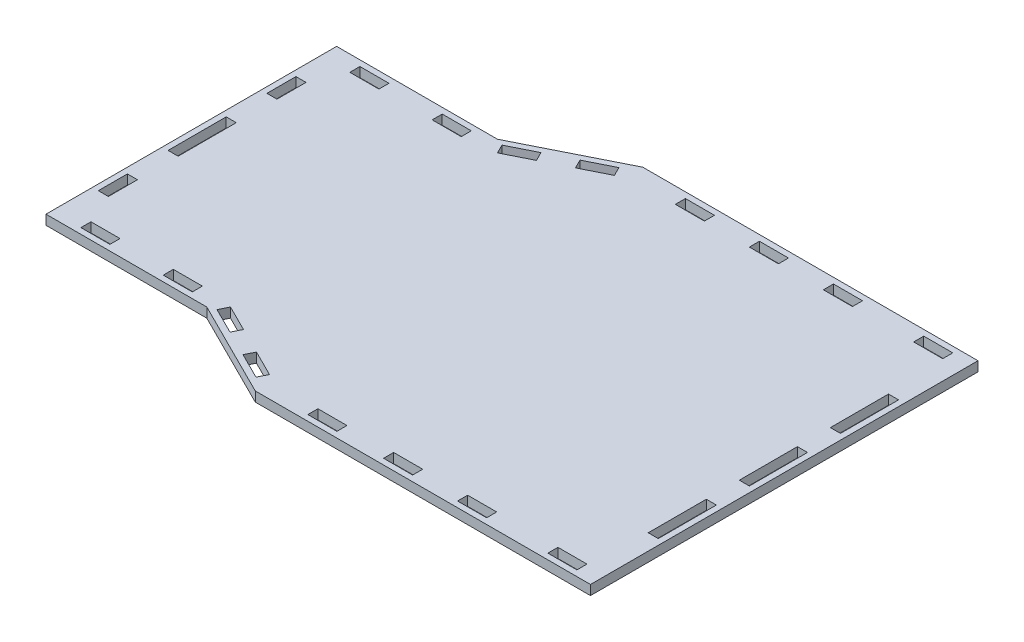
from build123d import *

# Parameters (mm, degrees)
SKETCH1_W           = 15
SKETCH1_H           = 5.2
SKETCH1_W_2         = 5.2
SKETCH1_H_2         = 30
SKETCH1_H_3         = 15
BOSS_EXTRUDE1_DEPTH = 5


with BuildPart() as part:
    # Sketch1 → Boss-Extrude1 (new body)
    with BuildSketch(Plane(origin=(0, 0, 0), x_dir=(1, 0, 0), z_dir=(0, 1, 0))):
        Polygon((92.514530464, -147.019914311), (92.514530464, 52.980085689), (-80.485469536, 52.980085689), (-130.485469536, 27.980085689), (-213.485469536, 27.980085689), (-213.485469536, -122.019914311), (-130.485469536, -122.019914311), (-80.485469536, -147.019914311), align=None)
        with Locations((75.014530464, 47.380085689)):
            Rectangle(SKETCH1_W, SKETCH1_H, mode=Mode.SUBTRACT)
        with Locations((75.014530464, -141.419914311)):
            Rectangle(SKETCH1_W, SKETCH1_H, mode=Mode.SUBTRACT)
        with Locations((86.914530464, -0.019914311)):
            Rectangle(SKETCH1_W_2, SKETCH1_H_2, mode=Mode.SUBTRACT)
        with Locations((86.914530464, -47.019914311)):
            Rectangle(SKETCH1_W_2, SKETCH1_H_2, mode=Mode.SUBTRACT)
        with Locations((86.914530464, -94.019914311)):
            Rectangle(SKETCH1_W_2, SKETCH1_H_2, mode=Mode.SUBTRACT)
        with Locations((-9.785469536, 47.373767599)):
            Rectangle(SKETCH1_W, SKETCH1_H, mode=Mode.SUBTRACT)
        with Locations((-47.985469536, 47.373767599)):
            Rectangle(SKETCH1_W, SKETCH1_H, mode=Mode.SUBTRACT)
        with Locations((-148.485469536, 22.380085689)):
            Rectangle(SKETCH1_W, SKETCH1_H, mode=Mode.SUBTRACT)
        with Locations((-190.985469536, 22.380085689)):
            Rectangle(SKETCH1_W, SKETCH1_H, mode=Mode.SUBTRACT)
        with Locations((-207.885469536, -3.519914311)):
            Rectangle(SKETCH1_W_2, SKETCH1_H_3, mode=Mode.SUBTRACT)
        with Locations((-207.885469536, -47.019914311)):
            Rectangle(SKETCH1_W_2, SKETCH1_H_2, mode=Mode.SUBTRACT)
        with Locations((-207.885469536, -90.519914311)):
            Rectangle(SKETCH1_W_2, SKETCH1_H_3, mode=Mode.SUBTRACT)
        with Locations((-48.86060515, -141.420106162)):
            Rectangle(SKETCH1_W, SKETCH1_H, mode=Mode.SUBTRACT)
        with Locations((-148.485469536, -116.419914311)):
            Rectangle(SKETCH1_W, SKETCH1_H, mode=Mode.SUBTRACT)
        with Locations((-190.985469536, -116.419914311)):
            Rectangle(SKETCH1_W, SKETCH1_H, mode=Mode.SUBTRACT)
        with Locations((28.414530464, 47.380085689)):
            Rectangle(SKETCH1_W, SKETCH1_H, mode=Mode.SUBTRACT)
        with Locations((28.414530464, -141.419914311)):
            Rectangle(SKETCH1_W, SKETCH1_H, mode=Mode.SUBTRACT)
        with Locations((-9.785469536, -141.413596222)):
            Rectangle(SKETCH1_W, SKETCH1_H, mode=Mode.SUBTRACT)
        Polygon((-110.963133782, 28.573374858), (-113.288285266, 33.223677824), (-126.704693131, 26.515473891), (-124.379541647, 21.865170925), align=None, mode=Mode.SUBTRACT)
        Polygon((-86.455469536, 46.640085689), (-84.130318052, 41.989782723), (-97.546725917, 35.28157879), (-99.871877401, 39.931881756), align=None, mode=Mode.SUBTRACT)
        Polygon((-99.871877401, -133.971710379), (-86.455469536, -140.679914311), (-84.130318052, -136.029611345), (-97.546725917, -129.321407413), align=None, mode=Mode.SUBTRACT)
        Polygon((-124.379541647, -115.904999548), (-110.963133782, -122.61320348), (-113.288285266, -127.263506446), (-126.704693131, -120.555302514), align=None, mode=Mode.SUBTRACT)
    extrude(amount=BOSS_EXTRUDE1_DEPTH)


solid = part.part
